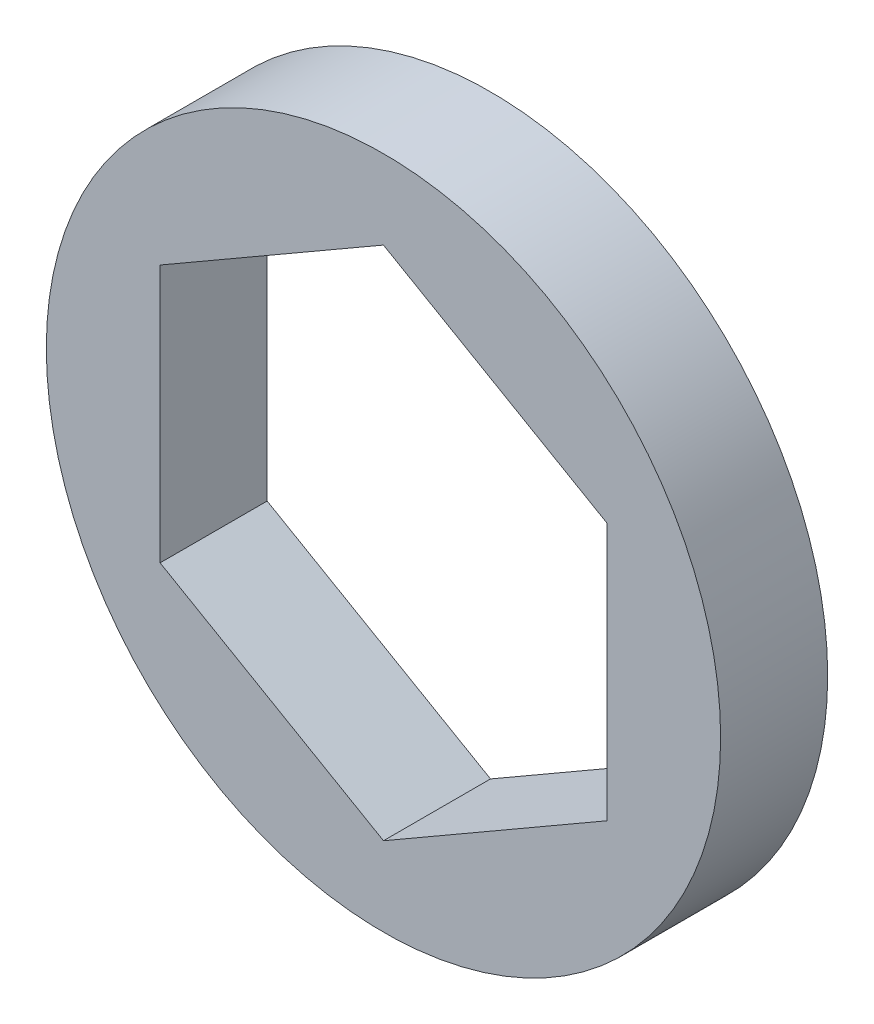
from build123d import *

# Parameters (mm, degrees)
SKETCH1_R           = 10.16
BOSS_EXTRUDE1_DEPTH = 1.6129


with BuildPart() as part:
    # Sketch1 → Boss-Extrude1 (new, symmetric)
    with BuildSketch(Plane.XY):
        Circle(SKETCH1_R)
        Polygon((0, 7.772289324), (-6.731, 3.886144662), (-6.731, -3.886144662), (0, -7.772289324), (6.731, -3.886144662), (6.731, 3.886144662), align=None, mode=Mode.SUBTRACT)
    extrude(amount=BOSS_EXTRUDE1_DEPTH, both=True)


solid = part.part
